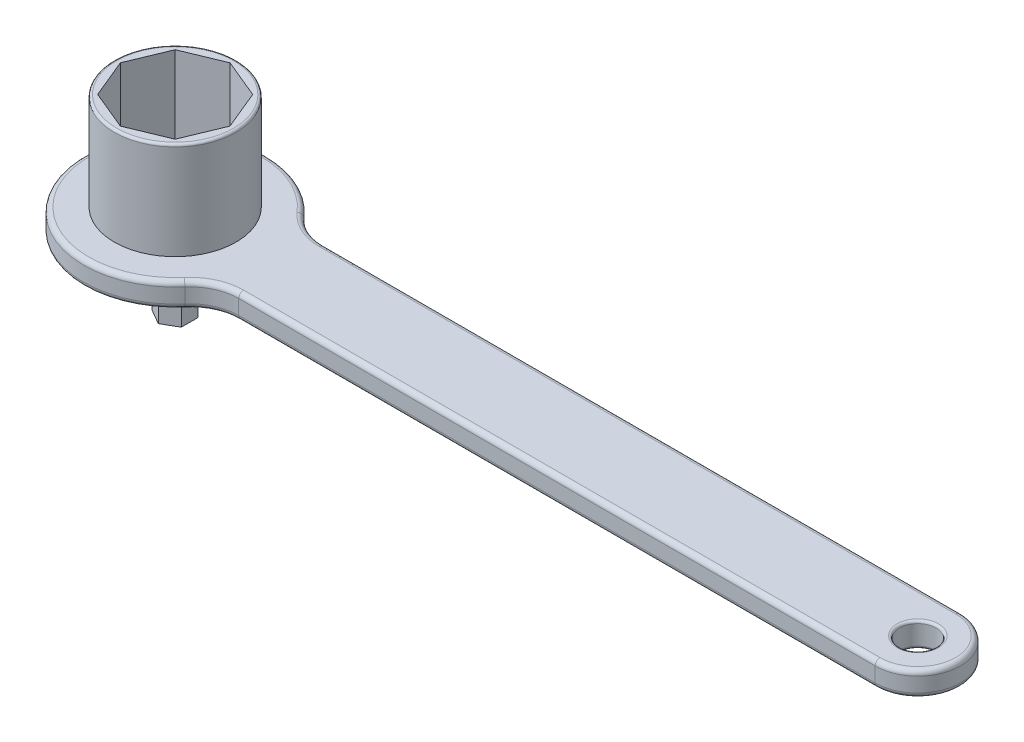
from build123d import *

# Parameters (mm, degrees)
SKETCH1_R           = 7.5
BOSS_EXTRUDE1_DEPTH = 10
SKETCH1_3_R         = 25
BOSS_EXTRUDE2_DEPTH = 40
CUT_EXTRUDE1_DEPTH  = 40
BOSS_EXTRUDE3_DEPTH = 3
BOSS_EXTRUDE4_DEPTH = 25
FILLET1_R           = 2
FILLET2_R           = 1


with BuildPart() as part:
    # Sketch1 → Boss-Extrude1 (new body)
    with BuildSketch(Plane(origin=(0, 0, 0), x_dir=(1, 0, 0), z_dir=(0, 1, 0))):
        with BuildLine():
            ThreePointArc((152.4, -17.5), (169.9, 0), (152.4, 17.5))
            Line((152.4, 17.5), (-108.811010565, 17.5))
            ThreePointArc((-108.811010565, 17.5), (-117.151587127, 19.322134817), (-123.972398194, 24.456521739))
            ThreePointArc((-123.972398194, 24.456521739), (-189.9, 0), (-123.972398194, -24.456521739))
            ThreePointArc((-123.972398194, -24.456521739), (-117.151587127, -19.322134817), (-108.811010565, -17.5))
            Line((-108.811010565, -17.5), (152.4, -17.5))
        make_face()
        with Locations((152.4, 0)):
            Circle(SKETCH1_R, mode=Mode.SUBTRACT)
    extrude(amount=-BOSS_EXTRUDE1_DEPTH)

    # Sketch1<3> → Boss-Extrude2 (add)
    with BuildSketch(Plane(origin=(0, 0, 0), x_dir=(1, 0, 0), z_dir=(0, 1, 0))):
        with Locations((-152.4, 0)):
            Circle(SKETCH1_3_R)
    extrude(amount=BOSS_EXTRUDE2_DEPTH)

    # Sketch2 → Cut-Extrude1 (cut)
    with BuildSketch(Plane(origin=(0, 40, 0), x_dir=(1, 0, 0), z_dir=(0, 1, 0))):
        Polygon((-129.9, 0), (-136.490097423, 15.909902577), (-152.4, 22.5), (-168.309902577, 15.909902577), (-174.9, 0), (-168.309902577, -15.909902577), (-152.4, -22.5), (-136.490097423, -15.909902577), align=None)
    extrude(amount=-CUT_EXTRUDE1_DEPTH, mode=Mode.SUBTRACT)

    # Sketch3 → Boss-Extrude3 (add)
    with BuildSketch(Plane.XZ.offset(10)):
        Polygon((-139.409618943, 7.5), (-152.4, 15), (-165.390381057, 7.5), (-165.390381057, -7.5), (-152.4, -15), (-139.409618943, -7.5), align=None)
    extrude(amount=BOSS_EXTRUDE3_DEPTH)

    # Sketch4 → Boss-Extrude4 (add)
    with BuildSketch(Plane.XZ.offset(13)):
        Polygon((-146.402774079, 3.4625), (-152.4, 6.925), (-158.397225921, 3.4625), (-158.397225921, -3.4625), (-152.4, -6.925), (-146.402774079, -3.4625), (-146.402774079, 0), align=None)
    extrude(amount=BOSS_EXTRUDE4_DEPTH)

    # Fillet1
    fillet1_edges = [part.edges().sort_by_distance(p)[0] for p in [
        (169.9, -10, 0),
        (-117.151587127, -10, -19.322134817),
        (-117.151587127, -10, 19.322134817),
        (21.794494718, -10, 17.5),
        (21.794494718, -10, -17.5),
        (-189.9, -10, 0),
        (-117.151587127, 0, -19.322134817),
        (-117.151587127, 0, 19.322134817),
        (-189.9, 0, 0),
        (21.794494718, 0, -17.5),
        (21.794494718, 0, 17.5),
        (169.9, 0, 0),
    ]]
    fillet(fillet1_edges, radius=FILLET1_R)

    # Fillet2
    fillet2_edges = [part.edges().sort_by_distance(p)[0] for p in [
        (144.9, -10, 0),
        (144.9, 0, 0),
        (-177.4, 40, 0),
    ]]
    fillet(fillet2_edges, radius=FILLET2_R)


solid = part.part
